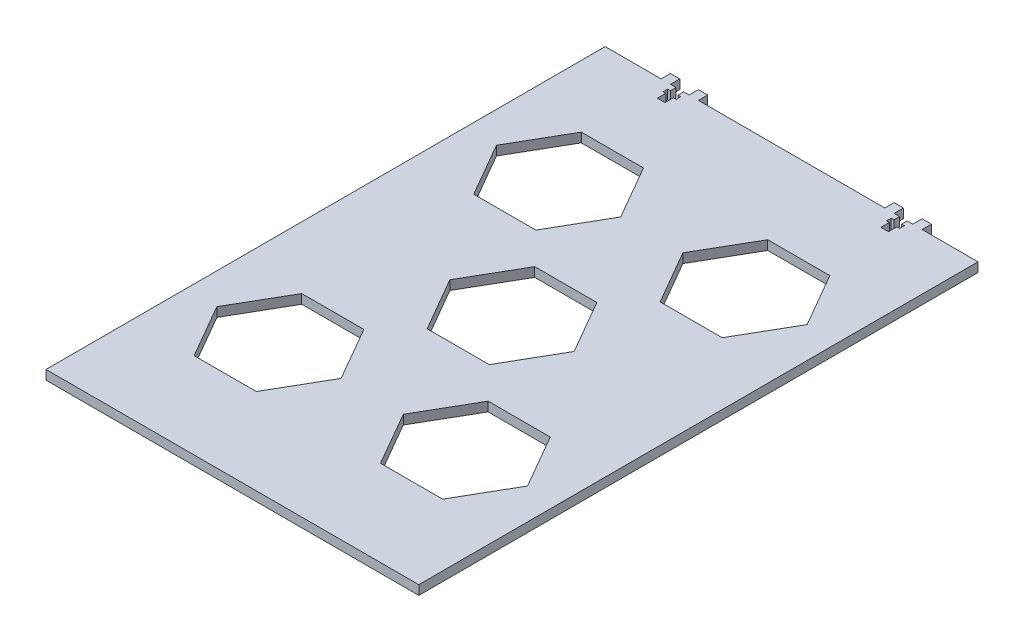
from build123d import *

# Parameters (mm, degrees)
BOSS_EXTRUDE1_DEPTH = 5
CUT_EXTRUDE1_DEPTH  = 5


with BuildPart() as part:
    # Sketch1 → Boss-Extrude1 (new body)
    with BuildSketch(Plane(origin=(0, 0, 0), x_dir=(1, 0, 0), z_dir=(0, 1, 0))):
        Polygon((-163.000117017, 189.802822602), (-133.000117017, 189.802822602), (-133.000117017, 194.802822602), (-128.000117017, 194.802822602), (-128.000117017, 189.802822602), (-125.000117017, 189.802822602), (-125.000117017, 186.802822602), (-126.500117017, 186.802822602), (-126.500117017, 184.302822602), (-125.000117017, 184.302822602), (-125.000117017, 179.802822602), (-120.929768881, 179.802822602), (-120.929768881, 184.302822602), (-119.429768881, 184.302822602), (-119.429768881, 186.802822602), (-120.929768881, 186.802822602), (-120.929768881, 189.802822602), (-118.000117017, 189.802822602), (-118.000117017, 194.802822602), (-113.000117017, 194.802822602), (-113.000117017, 189.802822602), (-13.000117017, 189.802822602), (-13.000117017, 194.802822602), (-8.000117017, 194.802822602), (-8.000117017, 189.802822602), (-5.070465153, 189.802822602), (-5.070465153, 186.802822602), (-6.570465153, 186.802822602), (-6.570465153, 184.302822602), (-5.070465153, 184.302822602), (-5.070465153, 179.802822602), (-1.000117017, 179.802822602), (-1.000117017, 184.302822602), (0.499882983, 184.302822602), (0.499882983, 186.802822602), (-1.000117017, 186.802822602), (-1.000117017, 189.802822602), (1.999882983, 189.802822602), (1.999882983, 194.802822602), (6.999882983, 194.802822602), (6.999882983, 189.802822602), (36.999882983, 189.802822602), (36.999882983, -110.197177398), (-163.000117017, -110.197177398), align=None)
    extrude(amount=BOSS_EXTRUDE1_DEPTH)

    # Sketch2 → Cut-Extrude1 (cut)
    with BuildSketch(Plane(origin=(0, 5, 0), x_dir=(1, 0, 0), z_dir=(0, 1, 0))):
        Polygon((3.664882983, 143.66744931), (20.329882983, 114.802822602), (3.664882983, 85.938195894), (-29.665117017, 85.938195894), (-46.330117017, 114.802822602), (-29.665117017, 143.66744931), align=None)
        Polygon((-79.670117017, 114.802822602), (-96.335117017, 143.66744931), (-129.665117017, 143.66744931), (-146.330117017, 114.802822602), (-129.665117017, 85.938195894), (-96.335117017, 85.938195894), align=None)
        Polygon((-29.665117017, -64.061804106), (3.664882983, -64.061804106), (20.329882983, -35.197177398), (3.664882983, -6.33255069), (-29.665117017, -6.33255069), (-46.330117017, -35.197177398), align=None)
        Polygon((-79.670117017, -35.197177398), (-96.335117017, -64.061804106), (-129.665117017, -64.061804106), (-146.330117017, -35.197177398), (-129.665117017, -6.33255069), (-96.335117017, -6.33255069), align=None)
        Polygon((-29.670117017, 39.802822602), (-46.335117017, 68.66744931), (-79.665117017, 68.66744931), (-96.330117017, 39.802822602), (-79.665117017, 10.938195894), (-46.335117017, 10.938195894), align=None)
    extrude(amount=-CUT_EXTRUDE1_DEPTH, mode=Mode.SUBTRACT)


solid = part.part
